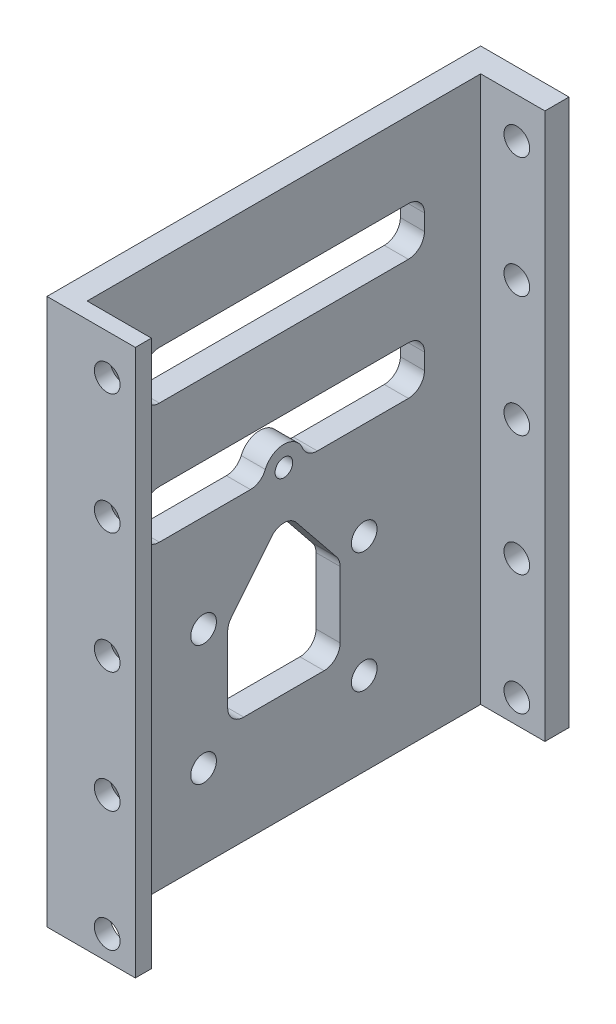
from build123d import *

# Parameters (mm, degrees)
EXTRUDE_1_DEPTH          = 120
SKETCH_2_R               = 1.6
CUT_EXTRUDE_1_DEPTH      = 120
SKETCH_3_R               = 1.6
CUT_EXTRUDE_2_DEPTH      = 10
SKETCH_4_R               = 1.1
CUT_EXTRUDE_3_DEPTH      = 12
SKETCH_5_W               = 11
SKETCH_5_H               = 120
EXTRUDE_2_DEPTH          = 2
SKETCH_6_W               = 49
SKETCH_6_H               = 30
CUT_EXTRUDE_4_DEPTH      = 10
CUT_EXTRUDE_5_DEPTH      = 42
CUT_EXTRUDE_5_DEPTH_BACK = 16
SKETCH_7_W               = 3
SKETCH_7_H               = 30
CUT_EXTRUDE_6_DEPTH      = 35
CUT_EXTRUDE_6_DEPTH_BACK = 11
SKETCH_8_W               = 52
SKETCH_8_H               = 12
SKETCH_9_W               = 2
SKETCH_9_H               = 42
CUT_EXTRUDE_7_DEPTH      = 20
SKETCH_10_W              = 11
SKETCH_10_H              = 54
CUT_EXTRUDE_8_DEPTH      = 10
SKETCH_11_W              = 11
SKETCH_11_H              = 68
SKETCH_11_R              = 1.6
EXTRUDE_3_DEPTH          = 1
SKETCH_12_W              = 11
SKETCH_12_H              = 1
CUT_EXTRUDE_9_DEPTH      = 91
CUT_EXTRUDE_10_DEPTH     = 10
SKETCH_14_W              = 35
SKETCH_14_H              = 6
CUT_EXTRUDE_11_DEPTH     = 10
FILLET_1_R               = 2


with BuildPart() as part:
    # 草图1 → 凸台-拉伸1 (new body)
    with BuildSketch(Plane(origin=(0, 0, 0), x_dir=(1, 0, 0), z_dir=(0, 1, 0))):
        Polygon((0, 0), (8, 0), (8, -3), (-3, -3), (-3, 49), (0, 49), align=None)
    extrude(amount=EXTRUDE_1_DEPTH)

    # 草图2 → 切除-拉伸1 (cut)
    with BuildSketch(Plane(origin=(0, 0, 0), x_dir=(-1, 0, 0), z_dir=(0, 0, -1))):
        with Locations((-4.5, 60)):
            Circle(SKETCH_2_R)
        with Locations((-4.5, 45)):
            Circle(SKETCH_2_R)
        with Locations((-4.5, 30)):
            Circle(SKETCH_2_R)
        with Locations((-4.5, 15)):
            Circle(SKETCH_2_R)
        with Locations((-4.5, 75)):
            Circle(SKETCH_2_R)
        with Locations((-4.5, 90)):
            Circle(SKETCH_2_R)
        with Locations((-4.5, 105)):
            Circle(SKETCH_2_R)
    cut_extrude_1 = extrude(amount=-CUT_EXTRUDE_1_DEPTH, mode=Mode.SUBTRACT)

    # 草图3 → 切除-拉伸2 (cut)
    with BuildSketch(Plane(origin=(0, 0, 0), x_dir=(0, 0, -1), z_dir=(1, 0, 0))):
        with Locations((14.5, 7.384470662)):
            Circle(SKETCH_3_R)
        with Locations((14.5, 22.384470662)):
            Circle(SKETCH_3_R)
        with Locations((14.5, 37.384470662)):
            Circle(SKETCH_3_R)
        with Locations((14.5, 52.384470662)):
            Circle(SKETCH_3_R)
        with Locations((14.5, 67.384470662)):
            Circle(SKETCH_3_R)
        with Locations((34.5, 67.384470662)):
            Circle(SKETCH_3_R)
        with Locations((34.5, 52.384470662)):
            Circle(SKETCH_3_R)
        with Locations((34.5, 37.384470662)):
            Circle(SKETCH_3_R)
        with Locations((34.5, 22.384470662)):
            Circle(SKETCH_3_R)
        with Locations((34.5, 7.384470662)):
            Circle(SKETCH_3_R)
    extrude(amount=-CUT_EXTRUDE_2_DEPTH, mode=Mode.SUBTRACT)

    # 草图4 → 切除-拉伸3 (cut)
    with BuildSketch(Plane(origin=(0, 0, 0), x_dir=(0, 0, -1), z_dir=(1, 0, 0))):
        with Locations((15.7, 117)):
            Circle(SKETCH_4_R)
        with Locations((33.3, 117)):
            Circle(SKETCH_4_R)
        with Locations((24.5, 79.8)):
            Circle(SKETCH_4_R)
    extrude(amount=-CUT_EXTRUDE_3_DEPTH, mode=Mode.SUBTRACT)

    # 草图5 → 凸台-拉伸2 (add)
    with BuildSketch(Plane(origin=(0, 0, -49), x_dir=(-1, 0, 0), z_dir=(0, 0, -1))):
        with Locations((-2.5, 60)):
            Rectangle(SKETCH_5_W, SKETCH_5_H)
    extrude(amount=EXTRUDE_2_DEPTH)

    # 镜向3: 切除-拉伸1 across plane
    add(cut_extrude_1.mirror(Plane(origin=(0, 0, -24.5), x_dir=(1, 0, 0), z_dir=(0, 0, -1))), mode=Mode.SUBTRACT)

    # 草图6 → 切除-拉伸4 (cut)
    with BuildSketch(Plane(origin=(0, 0, 0), x_dir=(0, 0, -1), z_dir=(1, 0, 0))):
        with Locations((24.5, 15)):
            Rectangle(SKETCH_6_W, SKETCH_6_H)
    extrude(amount=-CUT_EXTRUDE_4_DEPTH, mode=Mode.SUBTRACT)

    # 草图7 → 切除-拉伸5 (cut, two sides: drawn at the far end of the back side and taken through both)
    with BuildSketch(Plane(origin=(0, 0, 0), x_dir=(0, 0, -1), z_dir=(1, 0, 0)).offset(-CUT_EXTRUDE_5_DEPTH_BACK)):
        with Locations((-1.5, 15)):
            Rectangle(SKETCH_7_W, SKETCH_7_H)
    extrude(amount=CUT_EXTRUDE_5_DEPTH + CUT_EXTRUDE_5_DEPTH_BACK, mode=Mode.SUBTRACT)

    # 草图8 → 切除-拉伸6 (cut, two sides: drawn at the far end of the back side and taken through both)
    with BuildSketch(Plane(origin=(0, 0, 0), x_dir=(0, 0, -1), z_dir=(1, 0, 0)).offset(-CUT_EXTRUDE_6_DEPTH_BACK)):
        with Locations((23, 36)):
            Rectangle(SKETCH_8_W, SKETCH_8_H)
    extrude(amount=CUT_EXTRUDE_6_DEPTH + CUT_EXTRUDE_6_DEPTH_BACK, mode=Mode.SUBTRACT)

    # 草图9 → 切除-拉伸7 (cut)
    with BuildSketch(Plane.ZY.offset(3)):
        with Locations((-50, 21)):
            Rectangle(SKETCH_9_W, SKETCH_9_H)
    extrude(amount=-CUT_EXTRUDE_7_DEPTH, mode=Mode.SUBTRACT)

    # 草图10 → 切除-拉伸8 (cut)
    with BuildSketch(Plane(origin=(0, 120, 0), x_dir=(1, 0, 0), z_dir=(0, 1, 0))):
        with Locations((2.5, 24)):
            Rectangle(SKETCH_10_W, SKETCH_10_H)
    extrude(amount=-CUT_EXTRUDE_8_DEPTH, mode=Mode.SUBTRACT)

    # 草图11 → 凸台-拉伸3 (add)
    with BuildSketch(Plane(origin=(0, 0, -51), x_dir=(-1, 0, 0), z_dir=(0, 0, -1))):
        with Locations((-2.5, 76)):
            Rectangle(SKETCH_11_W, SKETCH_11_H)
        with Locations((-4.5, 105)):
            Circle(SKETCH_11_R, mode=Mode.SUBTRACT)
        with Locations((-4.5, 45)):
            Circle(SKETCH_11_R, mode=Mode.SUBTRACT)
        with Locations((-4.5, 60)):
            Circle(SKETCH_11_R, mode=Mode.SUBTRACT)
        with Locations((-4.5, 75)):
            Circle(SKETCH_11_R, mode=Mode.SUBTRACT)
        with Locations((-4.5, 90)):
            Circle(SKETCH_11_R, mode=Mode.SUBTRACT)
    extrude(amount=EXTRUDE_3_DEPTH)

    # 草图12 → 切除-拉伸9 (cut)
    with BuildSketch(Plane(origin=(0, 110, 0), x_dir=(1, 0, 0), z_dir=(0, 1, 0))):
        with Locations((2.5, -2.5)):
            Rectangle(SKETCH_12_W, SKETCH_12_H)
    extrude(amount=-CUT_EXTRUDE_9_DEPTH, mode=Mode.SUBTRACT)

    # 草图13 → 切除-拉伸10 (cut)
    with BuildSketch(Plane.ZY.offset(3)):
        Polygon((-31.5, 66.326548237), (-24.5, 75.017418774), (-17.5, 66.326548237), (-17.5, 55.384470662), (-31.5, 55.384470662), align=None)
    extrude(amount=-CUT_EXTRUDE_10_DEPTH, mode=Mode.SUBTRACT)

    # 草图14 → 切除-拉伸11 (cut)
    with BuildSketch(Plane.ZY.offset(3)):
        with Locations((-24.5, 97.5)):
            Rectangle(SKETCH_14_W, SKETCH_14_H)
        with BuildLine():
            Line((-22.018065271, 79.5), (-7, 79.5))
            Line((-7, 79.5), (-7, 85.5))
            Line((-7, 85.5), (-42, 85.5))
            Line((-42, 85.5), (-42, 79.5))
            Line((-42, 79.5), (-26.981934729, 79.5))
            ThreePointArc((-26.981934729, 79.5), (-24.5, 82.3), (-22.018065271, 79.5))
        make_face()
    extrude(amount=-CUT_EXTRUDE_11_DEPTH, mode=Mode.SUBTRACT)

    # 圆角1
    fillet_1_edges = [part.edges().sort_by_distance(p)[0] for p in [
        (-1.5, 55.384470662, -31.5),
        (-1.5, 66.326548237, -31.5),
        (-1.5, 75.017418774, -24.5),
        (-1.5, 66.326548237, -17.5),
        (-1.5, 55.384470662, -17.5),
        (-1.5, 100.5, -7),
        (-1.5, 94.5, -7),
        (-1.5, 94.5, -42),
        (-1.5, 100.5, -42),
        (-1.5, 85.5, -7),
        (-1.5, 79.5, -7),
        (-1.5, 79.5, -22.018065271),
        (-1.5, 79.5, -26.981934729),
        (-1.5, 79.5, -42),
        (-1.5, 85.5, -42),
    ]]
    fillet(fillet_1_edges, radius=FILLET_1_R)


solid = part.part
